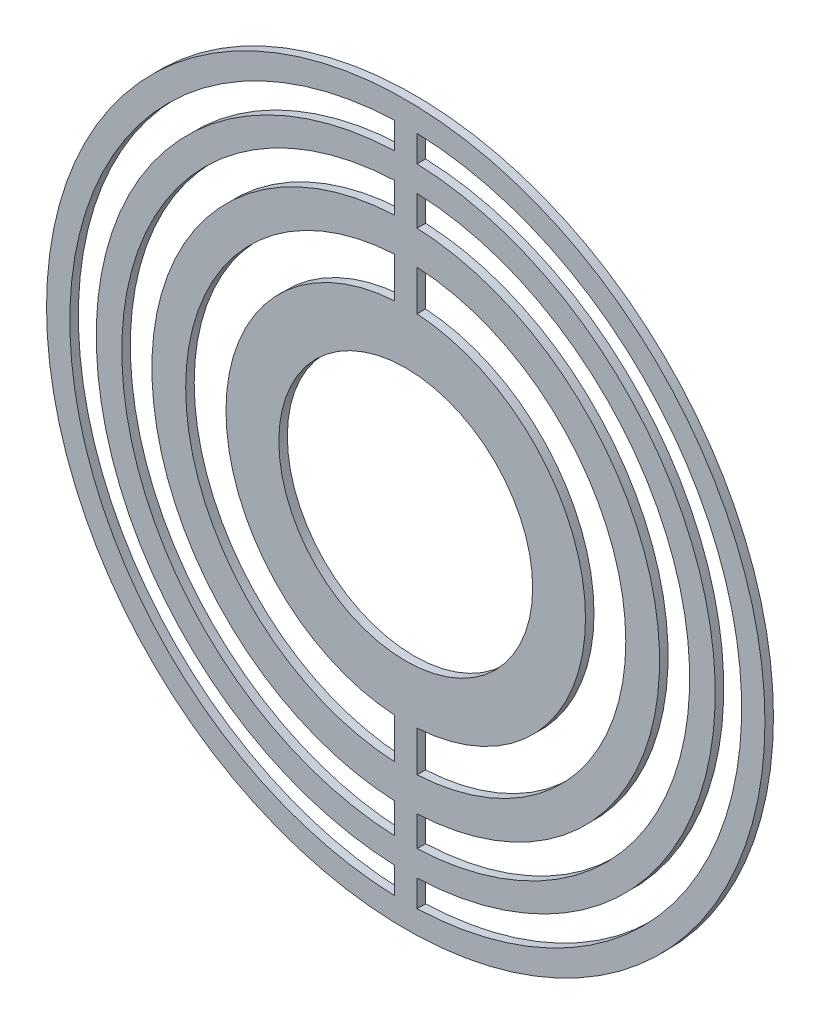
from build123d import *

# Parameters (mm, degrees)
SKETCH_1_R      = 126.5
SKETCH_1_R_2    = 44.7
EXTRUDE_1_DEPTH = 3


with BuildPart() as part:
    # 草图1 → 凸台-拉伸1 (new body)
    with BuildSketch(Plane.XY):
        Circle(SKETCH_1_R)
        Circle(SKETCH_1_R_2, mode=Mode.SUBTRACT)
        with BuildLine():
            Line((-4, 118.232355978), (-4, 108.926580778))
            ThreePointArc((-4, 108.926580778), (-109, 0), (-4, -108.926580778))
            Line((-4, -108.926580778), (-4, -118.232355978))
            ThreePointArc((-4, -118.232355978), (-118.3, 0), (-4, 118.232355978))
        make_face(mode=Mode.SUBTRACT)
        with BuildLine():
            Line((4, 118.232355978), (4, 108.926580778))
            ThreePointArc((4, 108.926580778), (109, 0), (4, -108.926580778))
            Line((4, -108.926580778), (4, -118.232355978))
            ThreePointArc((4, -118.232355978), (118.3, 0), (4, 118.232355978))
        make_face(mode=Mode.SUBTRACT)
        with BuildLine():
            Line((4, -63.173491276), (4, -77.396705356))
            ThreePointArc((4, -77.396705356), (77.5, 0), (4, 77.396705356))
            Line((4, 77.396705356), (4, 63.173491276))
            ThreePointArc((4, 63.173491276), (63.3, 0), (4, -63.173491276))
        make_face(mode=Mode.SUBTRACT)
        with BuildLine():
            Line((-4, -63.173491276), (-4, -77.396705356))
            ThreePointArc((-4, -77.396705356), (-77.5, 0), (-4, 77.396705356))
            Line((-4, 77.396705356), (-4, 63.173491276))
            ThreePointArc((-4, 63.173491276), (-63.3, 0), (-4, -63.173491276))
        make_face(mode=Mode.SUBTRACT)
        with BuildLine():
            Line((-4, 99.919967974), (-4, 89.310469711))
            ThreePointArc((-4, 89.310469711), (-89.4, 0), (-4, -89.310469711))
            Line((-4, -89.310469711), (-4, -99.919967974))
            ThreePointArc((-4, -99.919967974), (-100, 0), (-4, 99.919967974))
        make_face(mode=Mode.SUBTRACT)
        with BuildLine():
            Line((4, 99.919967974), (4, 89.310469711))
            ThreePointArc((4, 89.310469711), (89.4, 0), (4, -89.310469711))
            Line((4, -89.310469711), (4, -99.919967974))
            ThreePointArc((4, -99.919967974), (100, 0), (4, 99.919967974))
        make_face(mode=Mode.SUBTRACT)
    extrude(amount=EXTRUDE_1_DEPTH)


solid = part.part
